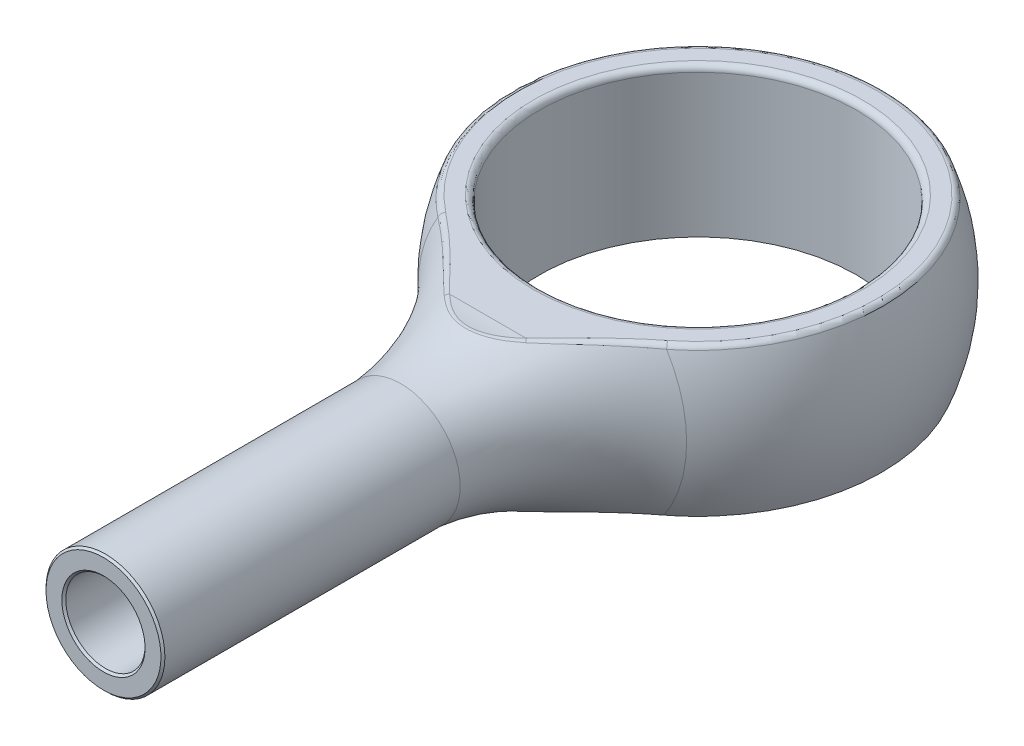
from build123d import *

# Parameters (mm, degrees)
CUT_EXTRUDE3_DEPTH      = 10
CUT_EXTRUDE3_DEPTH_BACK = 10
CUT_EXTRUDE4_DEPTH      = 10
CUT_EXTRUDE4_DEPTH_BACK = 10
SKETCH7_R               = 4
FILLET1_R               = 0.15
SKETCH8_R               = 1
CUT_EXTRUDE5_DEPTH      = 5
CHAMFER1_SIZE           = 0.05


with BuildPart() as part:
    # Sketch5 → Revolve2 (revolve)
    with BuildSketch(Plane(origin=(0, 0, 0), x_dir=(1, 0, 0), z_dir=(0, 1, 0))):
        with BuildLine():
            Line((-1.5, -15), (0, -15))
            Line((0, -15), (0, 5))
            ThreePointArc((0, 5), (-4.657160695, 1.819575298), (-3.389621823, -3.675658294))
            ThreePointArc((-3.389621823, -3.675658294), (-2.089993468, -5.412512495), (-1.5, -7.5))
            Line((-1.5, -7.5), (-1.5, -15))
        make_face()
    revolve(axis=Axis((0, 0, 15), (0, 0, -1)))

    # Sketch6 → Cut-Extrude3 (cut, two sides: drawn at the far end of the back side and taken through both)
    with BuildSketch(Plane(origin=(0, 0, 0), x_dir=(0, 0, -1), z_dir=(1, 0, 0)).offset(-CUT_EXTRUDE3_DEPTH_BACK)):
        with BuildLine():
            Line((-19.567307599, 10.758838429), (14.902121045, 10.758838429))
            Line((14.902121045, 10.758838429), (14.902121045, 1.875))
            Line((14.902121045, 1.875), (-5.303377511, 1.875))
            ThreePointArc((-5.303377511, 1.875), (-6.806906508, 2.106415246), (-8.171259692, 2.779239779))
            Line((-8.171259692, 2.779239779), (-19.567307599, 10.758838429))
        make_face()
        with BuildLine():
            Line((-8.171259692, -2.779239779), (-19.567307599, -10.758838429))
            Line((-19.567307599, -10.758838429), (14.902121045, -10.758838429))
            Line((14.902121045, -10.758838429), (14.902121045, -1.875))
            Line((14.902121045, -1.875), (-5.303377511, -1.875))
            ThreePointArc((-5.303377511, -1.875), (-6.806906508, -2.106415246), (-8.171259692, -2.779239779))
        make_face()
    extrude(amount=CUT_EXTRUDE3_DEPTH + CUT_EXTRUDE3_DEPTH_BACK, mode=Mode.SUBTRACT)

    # Sketch7 → Cut-Extrude4 (cut, two sides: drawn at the far end of the back side and taken through both)
    with BuildSketch(Plane(origin=(0, 0, 0), x_dir=(1, 0, 0), z_dir=(0, 1, 0)).offset(-CUT_EXTRUDE4_DEPTH_BACK)):
        Circle(SKETCH7_R)
    extrude(amount=CUT_EXTRUDE4_DEPTH + CUT_EXTRUDE4_DEPTH_BACK, mode=Mode.SUBTRACT)

    # Fillet1
    fillet1_edges = [part.edges().sort_by_distance(p)[0] for p in [
        (-4, 1.875, 0),
        (1.909227576, 1.875, 4.46296456),
        (-1e-09, 1.902919108, 5.831024745),
        (-1.909227576, 1.875, 4.46296456),
        (0, 1.875, -4.635124054),
    ]]
    fillet(fillet1_edges, radius=FILLET1_R)

    # Sketch8 → Cut-Extrude5 (cut)
    with BuildSketch(Plane.XY.offset(15)):
        Circle(SKETCH8_R)
    extrude(amount=-CUT_EXTRUDE5_DEPTH, mode=Mode.SUBTRACT)

    # Chamfer1
    chamfer1_edges = [part.edges().sort_by_distance(p)[0] for p in [
        (1.5, 0, 15),
        (-1, 0, 15),
    ]]
    chamfer(chamfer1_edges, length=CHAMFER1_SIZE)


solid = part.part
